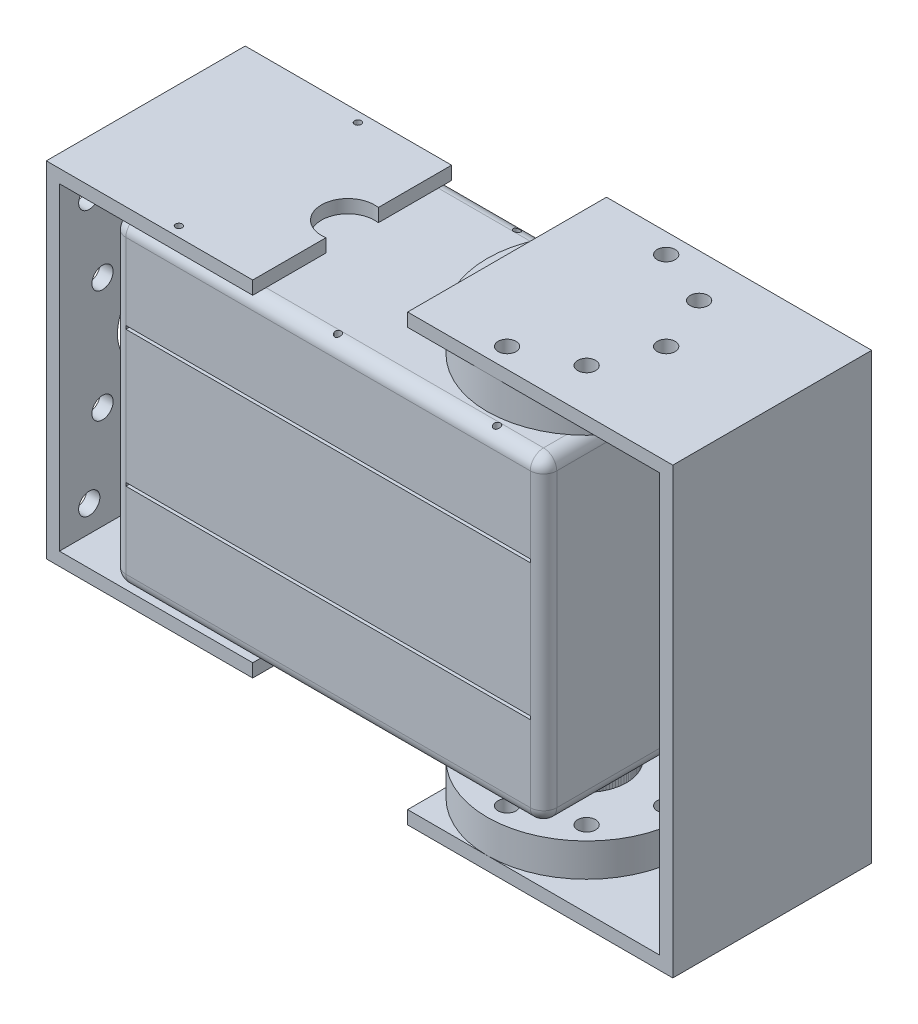
from build123d import *

# Parameters (mm, degrees)
SKETCH_1_W                 = 65
SKETCH_1_H                 = 48
EXTRUDE_1_DEPTH            = 30
FILLET_1_R                 = 2
SKETCH_3_R                 = 0.5
SKETCH_3_R_2               = 4
SKETCH_3_R_3               = 3.751032041
SKETCH_3_R_4               = 2.051230726
SKETCH_3_R_5               = 1.25
CUT_EXTRUDE_1_DEPTH        = 5
CUT_EXTRUDE_2_DEPTH        = 37.2
CUT_EXTRUDE_2_DEPTH_BACK   = 60
SKETCH_3_3_R               = 1.25
EXTRUDE_2_REACH            = 88.192
CUT_EXTRUDE_START          = 5
SKETCH_3_4_R               = 0.5
CUT_EXTRUDE_3_DEPTH        = 5
SKETCH_5_R                 = 4
CUT_EXTRUDE_4_DEPTH        = 2
SKETCH_7_R                 = 3.751032041
SKETCH_7_R_2               = 1.25
EXTRUDE_3_DEPTH            = 1
EXTRUDE_3_DRAFT            = 20
SKETCH_8_R                 = 6
SKETCH_8_R_2               = 3.387061806
EXTRUDE_4_DEPTH            = 1.5
MIRROR_1_COPY_1_SKETCH_R   = 3.751032041
MIRROR_1_COPY_1_SKETCH_R_2 = 1.25
MIRROR_1_COPY_1_DEPTH      = 1
MIRROR_1_COPY_1_DRAFT      = 20
SKETCH_9_R                 = 15
SKETCH_9_R_2               = 1.35
EXTRUDE_5_DEPTH            = 5
SKETCH_10_R                = 6
SKETCH_10_R_2              = 3.387061806
SKETCH_10_R_3              = 1.613970234
SKETCH_10_R_4              = 1.25
EXTRUDE_6_DEPTH            = 1.5
EXTRUDE_7_DEPTH            = 30
SKETCH_15_W                = 61
SKETCH_15_H                = 0.5
CUT_EXTRUDE_7_DEPTH        = 0.5
CUT_EXTRUDE_START_2        = -2
SKETCH_16_R                = 1.35
CUT_EXTRUDE_8_DEPTH        = 114.934132444
SKETCH_17_R                = 6.25
SKETCH_17_R_2              = 1.6
CUT_EXTRUDE_9_DEPTH        = 1.976324383


with BuildPart() as part:
    # 草图1 → 凸台-拉伸1 (new body)
    with BuildSketch(Plane.XY):
        with Locations((32.5, 24)):
            Rectangle(SKETCH_1_W, SKETCH_1_H)
    extrude(amount=EXTRUDE_1_DEPTH)

    # 圆角1
    fillet_1_edges = [part.edges().sort_by_distance(p)[0] for p in [
        (65, 24, 30),
        (32.5, 48, 30),
        (0, 24, 30),
        (32.5, 48, 0),
        (65, 24, 0),
        (32.5, 0, 0),
        (0, 24, 0),
        (0, 48, 15),
        (65, 48, 15),
        (65, 0, 15),
        (0, 0, 15),
        (32.5, 0, 30),
    ]]
    fillet(fillet_1_edges, radius=FILLET_1_R)

    # 草图3 → 切除-拉伸1 (cut)
    # profile 1 of 8: a face of its own
    with BuildSketch(Plane(origin=(0, 48, 0), x_dir=(1, 0, 0), z_dir=(0, 1, 0))):
        with Locations(Location((8.5, -1.5, 0), (0, 0, 270))):
            Circle(SKETCH_3_R)
    # profile 2 of 8: a face of its own
    with BuildSketch(Plane(origin=(0, 48, 0), x_dir=(1, 0, 0), z_dir=(0, 1, 0))):
        with Locations(Location((8.5, -28.5, 0), (0, 0, 270))):
            Circle(SKETCH_3_R)
    # profile 3 of 8: a face of its own
    with BuildSketch(Plane(origin=(0, 48, 0), x_dir=(1, 0, 0), z_dir=(0, 1, 0))):
        with Locations(Location((32.5, -1.5, 0), (0, 0, 270))):
            Circle(SKETCH_3_R)
    # profile 4 of 8: a face of its own
    with BuildSketch(Plane(origin=(0, 48, 0), x_dir=(1, 0, 0), z_dir=(0, 1, 0))):
        with Locations(Location((32.5, -28.5, 0), (0, 0, 270))):
            Circle(SKETCH_3_R)
    # profile 5 of 8: a face of its own
    with BuildSketch(Plane(origin=(0, 48, 0), x_dir=(1, 0, 0), z_dir=(0, 1, 0))):
        with Locations(Location((56.5, -15, 0), (0, 0, 270))):
            Circle(SKETCH_3_R_2)
        with Locations(Location((56.5, -15, 0), (0, 0, 270))):
            Circle(SKETCH_3_R_3, mode=Mode.SUBTRACT)
    # profile 6 of 8: a face of its own
    with BuildSketch(Plane(origin=(0, 48, 0), x_dir=(1, 0, 0), z_dir=(0, 1, 0))):
        with Locations(Location((56.5, -15, 0), (0, 0, 270))):
            Circle(SKETCH_3_R_4)
        with Locations(Location((56.5, -15, 0), (0, 0, 270))):
            Circle(SKETCH_3_R_5, mode=Mode.SUBTRACT)
    # profile 7 of 8: a face of its own
    with BuildSketch(Plane(origin=(0, 48, 0), x_dir=(1, 0, 0), z_dir=(0, 1, 0))):
        with Locations(Location((56.5, -1.5, 0), (0, 0, 270))):
            Circle(SKETCH_3_R)
    # profile 8 of 8: a face of its own
    with BuildSketch(Plane(origin=(0, 48, 0), x_dir=(1, 0, 0), z_dir=(0, 1, 0))):
        with Locations(Location((56.5, -28.5, 0), (0, 0, 270))):
            Circle(SKETCH_3_R)
    extrude(amount=-CUT_EXTRUDE_1_DEPTH, mode=Mode.SUBTRACT)

    # 草图3<3> → 切除-拉伸2 (cut, two sides: drawn at the far end of the back side and taken through both)
    with BuildSketch(Plane(origin=(0, 48, 0), x_dir=(1, 0, 0), z_dir=(0, 1, 0)).offset(-CUT_EXTRUDE_2_DEPTH_BACK)):
        with Locations(Location((56.5, -15, 0), (0, 0, 270))):
            Circle(SKETCH_3_3_R)
    extrude(amount=CUT_EXTRUDE_2_DEPTH + CUT_EXTRUDE_2_DEPTH_BACK, mode=Mode.SUBTRACT)

    # 凸台-拉伸2: up to this face of the body (flat: up to its plane)
    extrude_2_end = Plane(part.part.faces().sort_by_distance((32.5, 24, 30))[0])
    # 草图4 → 凸台-拉伸2 (add, up to the picked face)
    with BuildSketch(Plane.XY, mode=Mode.PRIVATE) as extrude_2_sk1:
        Polygon((21.133184655, 48), (21.133184655, 50), (-10, 50), (-10, -2), (21.133184655, -2), (21.133184655, 0), (20, 0), (0, 0), (-8.023675617, 0), (-8.023675617, 48), (0, 48), align=None)
    extrude_2_tool1 = split(extrude(extrude_2_sk1.sketch, amount=EXTRUDE_2_REACH, mode=Mode.PRIVATE), bisect_by=extrude_2_end, keep=Keep.BOTH, mode=Mode.PRIVATE)
    add(extrude_2_tool1.solids().sort_by(Axis((20.527109, 49, 0), (0, 0, 1)))[0])

    # 草图3<4> → 切除-拉伸3 (cut)
    with BuildSketch(Plane(origin=(0, 48, 0), x_dir=(1, 0, 0), z_dir=(0, 1, 0)).offset(CUT_EXTRUDE_START)):
        with Locations(Location((8.5, -28.5, 0), (0, 0, 270))):
            Circle(SKETCH_3_4_R)
        with Locations(Location((8.5, -1.5, 0), (0, 0, 270))):
            Circle(SKETCH_3_4_R)
        with Locations(Location((32.5, -1.5, 0), (0, 0, 270))):
            Circle(SKETCH_3_4_R)
        with Locations(Location((32.5, -28.5, 0), (0, 0, 270))):
            Circle(SKETCH_3_4_R)
    extrude(amount=-CUT_EXTRUDE_3_DEPTH, mode=Mode.SUBTRACT)

    # 草图5 → 切除-拉伸4 (cut)
    with BuildSketch(Plane(origin=(0, 50, 0), x_dir=(1, 0, 0), z_dir=(0, 1, 0))):
        with Locations((20.5, -15)):
            Circle(SKETCH_5_R)
    extrude(amount=-CUT_EXTRUDE_4_DEPTH, mode=Mode.SUBTRACT)


with BuildPart() as extrude_3_tool:
    # 草图7 → 凸台-拉伸3 (with draft: the straight prism first)
    with BuildSketch(Plane(origin=(0, 48, 0), x_dir=(1, 0, 0), z_dir=(0, 1, 0))):
        with Locations(Location((56.5, -15, 0), (0, 0, 270))):
            Circle(SKETCH_7_R)
        with Locations(Location((56.5, -15, 0), (0, 0, 270))):
            Circle(SKETCH_7_R_2, mode=Mode.SUBTRACT)
    extrude(amount=EXTRUDE_3_DEPTH)
    # 凸台-拉伸3: the draft: its side faces are tilted about the plane it starts from
    extrude_3_sides = [extrude_3_tool.faces().sort_by_distance(p)[0] for p in [
        (56.5, 48.5, 11.248967959),
        (56.5, 48.5, 13.75),
    ]]
    draft(extrude_3_sides, Plane(origin=(0, 48, 0), x_dir=(1, 0, 0), z_dir=(0, 1, 0)), EXTRUDE_3_DRAFT)


with BuildPart() as part_1:
    add(part.part)

    # 凸台-拉伸3: add extrude_3_tool
    add(extrude_3_tool.part)


with BuildPart() as body_2:
    # 草图8 → 凸台-拉伸4 (new body)
    with BuildSketch(Plane(origin=(0, 49, 0), x_dir=(1, 0, 0), z_dir=(0, 1, 0))):
        with Locations(Location((56.5, -15, 0), (0, 0, 270))):
            Circle(SKETCH_8_R)
        with Locations(Location((56.5, -15, 0), (0, 0, 270))):
            Circle(SKETCH_8_R_2, mode=Mode.SUBTRACT)
    extrude(amount=EXTRUDE_4_DEPTH)

    # 草图9 → 凸台-拉伸5 (add)
    with BuildSketch(Plane(origin=(0, 50.5, 0), x_dir=(1, 0, 0), z_dir=(0, 1, 0))):
        with Locations(Location((56.5, -15, 0), (0, 0, 270))):
            Circle(SKETCH_9_R)
        with Locations(Location((68.5, -15, 0), (0, 0, 270))):
            Circle(SKETCH_9_R_2, mode=Mode.SUBTRACT)
        with Locations(Location((64.985281374, -23.485281374, 0), (0, 0, 270))):
            Circle(SKETCH_9_R_2, mode=Mode.SUBTRACT)
        with Locations(Location((56.5, -27, 0), (0, 0, 270))):
            Circle(SKETCH_9_R_2, mode=Mode.SUBTRACT)
        with Locations(Location((48.014718626, -23.485281374, 0), (0, 0, 270))):
            Circle(SKETCH_9_R_2, mode=Mode.SUBTRACT)
        with Locations(Location((44.5, -15, 0), (0, 0, 270))):
            Circle(SKETCH_9_R_2, mode=Mode.SUBTRACT)
        with Locations(Location((48.014718626, -6.514718626, 0), (0, 0, 270))):
            Circle(SKETCH_9_R_2, mode=Mode.SUBTRACT)
        with Locations(Location((56.5, -3, 0), (0, 0, 270))):
            Circle(SKETCH_9_R_2, mode=Mode.SUBTRACT)
        with Locations(Location((64.985281374, -6.514718626, 0), (0, 0, 270))):
            Circle(SKETCH_9_R_2, mode=Mode.SUBTRACT)
    extrude(amount=EXTRUDE_5_DEPTH)


with BuildPart() as mirror_1_copy_1_tool:
    # 镜向1 copy 1 sketch → 镜向1 copy 1 (with draft: the straight prism first)
    with BuildSketch(Plane.XZ):
        with Locations((56.5, 15)):
            Circle(MIRROR_1_COPY_1_SKETCH_R)
        with Locations((56.5, 15)):
            Circle(MIRROR_1_COPY_1_SKETCH_R_2, mode=Mode.SUBTRACT)
    extrude(amount=MIRROR_1_COPY_1_DEPTH)
    # 镜向1 copy 1: the draft: its side faces are tilted about the plane it starts from
    mirror_1_copy_1_sides = [mirror_1_copy_1_tool.faces().sort_by_distance(p)[0] for p in [
        (56.5, -0.5, 11.248967959),
        (56.5, -0.5, 13.75),
    ]]
    draft(mirror_1_copy_1_sides, Plane.XZ, MIRROR_1_COPY_1_DRAFT)


with BuildPart() as part_2:
    add(part_1.part)

    # 镜向1 copy 1: add mirror_1_copy_1_tool
    add(mirror_1_copy_1_tool.part)

    # 草图10 → 凸台-拉伸6 (add)
    # profile 1 of 3: a face of its own
    with BuildSketch(Plane.XZ.offset(1)):
        with Locations(Location((56.5, 15, 0), (0, 0, 90))):
            Circle(SKETCH_10_R)
        with Locations(Location((56.5, 15, 0), (0, 0, 90))):
            Circle(SKETCH_10_R_2, mode=Mode.SUBTRACT)
    # profile 2 of 3: a face of its own
    with BuildSketch(Plane.XZ.offset(1)):
        with Locations(Location((56.5, 15, 0), (0, 0, 90))):
            Circle(SKETCH_10_R_2)
        with Locations((56.5, 15)):
            Circle(SKETCH_10_R_3, mode=Mode.SUBTRACT)
    # profile 3 of 3: a face of its own
    with BuildSketch(Plane.XZ.offset(1)):
        with Locations((56.5, 15)):
            Circle(SKETCH_10_R_3)
        with Locations(Location((56.5, 15, 0), (0, 0, 90))):
            Circle(SKETCH_10_R_4, mode=Mode.SUBTRACT)
    extrude(amount=EXTRUDE_6_DEPTH)

    # 草图15 → 切除-拉伸7 (cut)
    with BuildSketch(Plane.XY.offset(30)):
        with Locations((32.5, 34.25)):
            Rectangle(SKETCH_15_W, SKETCH_15_H)
        with Locations((32.5, 13.75)):
            Rectangle(SKETCH_15_W, SKETCH_15_H)
    extrude(amount=-CUT_EXTRUDE_7_DEPTH, mode=Mode.SUBTRACT)

    # 草图17 → 切除-拉伸9 (cut)
    with BuildSketch(Plane.ZY.offset(10)):
        with Locations(Location((15, 24, 0), (0, 0, 270))):
            Circle(SKETCH_17_R)
        with Locations(Location((23.5, 32.5, 0), (0, 0, 270))):
            Circle(SKETCH_17_R_2)
        with Locations(Location((6.5, 32.5, 0), (0, 0, 270))):
            Circle(SKETCH_17_R_2)
        with Locations(Location((6.5, 15.5, 0), (0, 0, 270))):
            Circle(SKETCH_17_R_2)
        with Locations(Location((23.5, 15.5, 0), (0, 0, 270))):
            Circle(SKETCH_17_R_2)
        with Locations(Location((25.5, 44, 0), (0, 0, 270))):
            Circle(SKETCH_17_R_2)
        with Locations(Location((4.5, 44, 0), (0, 0, 270))):
            Circle(SKETCH_17_R_2)
        with Locations(Location((4.5, 4, 0), (0, 0, 270))):
            Circle(SKETCH_17_R_2)
        with Locations(Location((25.5, 4, 0), (0, 0, 270))):
            Circle(SKETCH_17_R_2)
    extrude(amount=-CUT_EXTRUDE_9_DEPTH, mode=Mode.SUBTRACT)


with BuildPart() as body_3:
    # 草图11 → 凸台-拉伸7 (new body)
    with BuildSketch(Plane(origin=(0, 0, 0), x_dir=(-1, 0, 0), z_dir=(0, 0, -1))):
        Polygon((-44.5, 55.5), (-82.5, 55.5), (-82.5, -7.5), (-44.5, -7.5), (-44.5, -9.5), (-84.5, -9.5), (-84.5, 57.5), (-44.5, 57.5), align=None)
    extrude(amount=-EXTRUDE_7_DEPTH)

    # 草图16 → 切除-拉伸8 (cut)
    with BuildSketch(Plane.XZ.offset(9.5).offset(CUT_EXTRUDE_START_2)):
        with Locations(Location((56.5, 27, 0), (0, 0, 90))):
            Circle(SKETCH_16_R)
        with Locations(Location((64.985281374, 23.485281374, 0), (0, 0, 90))):
            Circle(SKETCH_16_R)
        with Locations(Location((68.5, 15, 0), (0, 0, 90))):
            Circle(SKETCH_16_R)
        with Locations(Location((64.985281374, 6.514718626, 0), (0, 0, 90))):
            Circle(SKETCH_16_R)
        with Locations(Location((56.5, 3, 0), (0, 0, 90))):
            Circle(SKETCH_16_R)
    cut_extrude_8 = extrude(amount=CUT_EXTRUDE_8_DEPTH, mode=Mode.SUBTRACT)

    # 镜向5: 切除-拉伸8 across plane
    add(cut_extrude_8.mirror(Plane.ZX.offset(24)), mode=Mode.SUBTRACT)


with BuildPart() as body_4:
    # 镜向4: mirrored copy
    add(body_2.part.mirror(Plane.ZX.offset(24)))


solid = Compound([body_2.part, part_2.part, body_3.part, body_4.part])
